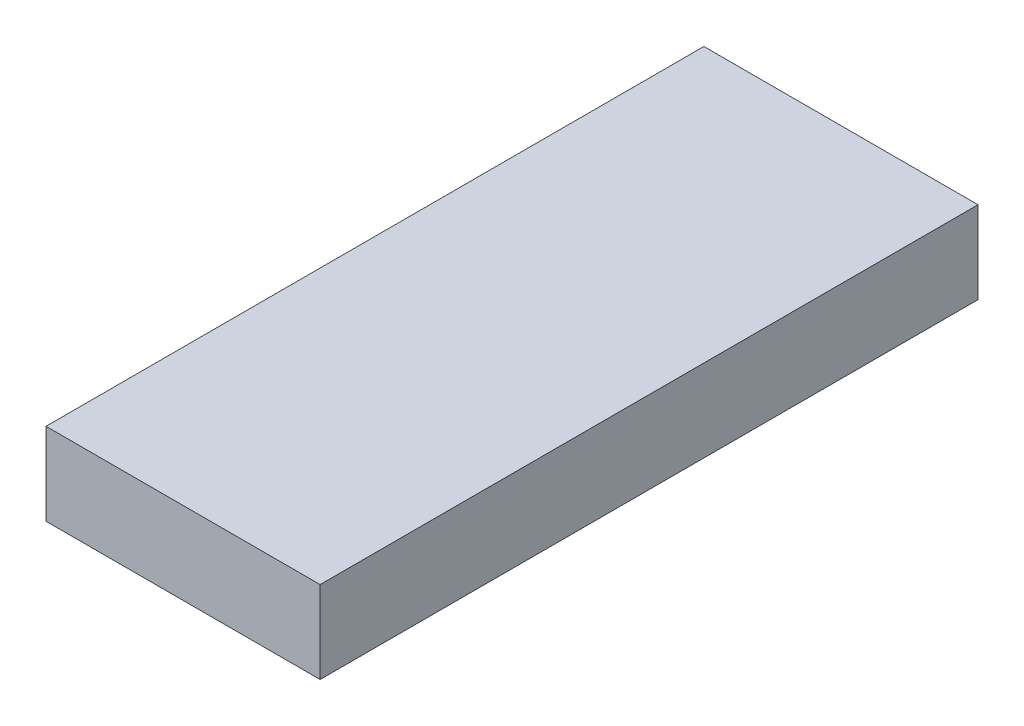
from build123d import *

# Parameters (mm, degrees)
SKETCH1_W           = 50
SKETCH1_H           = 120
BOSS_EXTRUDE1_DEPTH = 7.5


with BuildPart() as part:
    # Sketch1 → Boss-Extrude1 (new, symmetric)
    with BuildSketch(Plane(origin=(0, 0, 0), x_dir=(1, 0, 0), z_dir=(0, 1, 0))):
        Rectangle(SKETCH1_W, SKETCH1_H)
    extrude(amount=BOSS_EXTRUDE1_DEPTH, both=True)


solid = part.part
